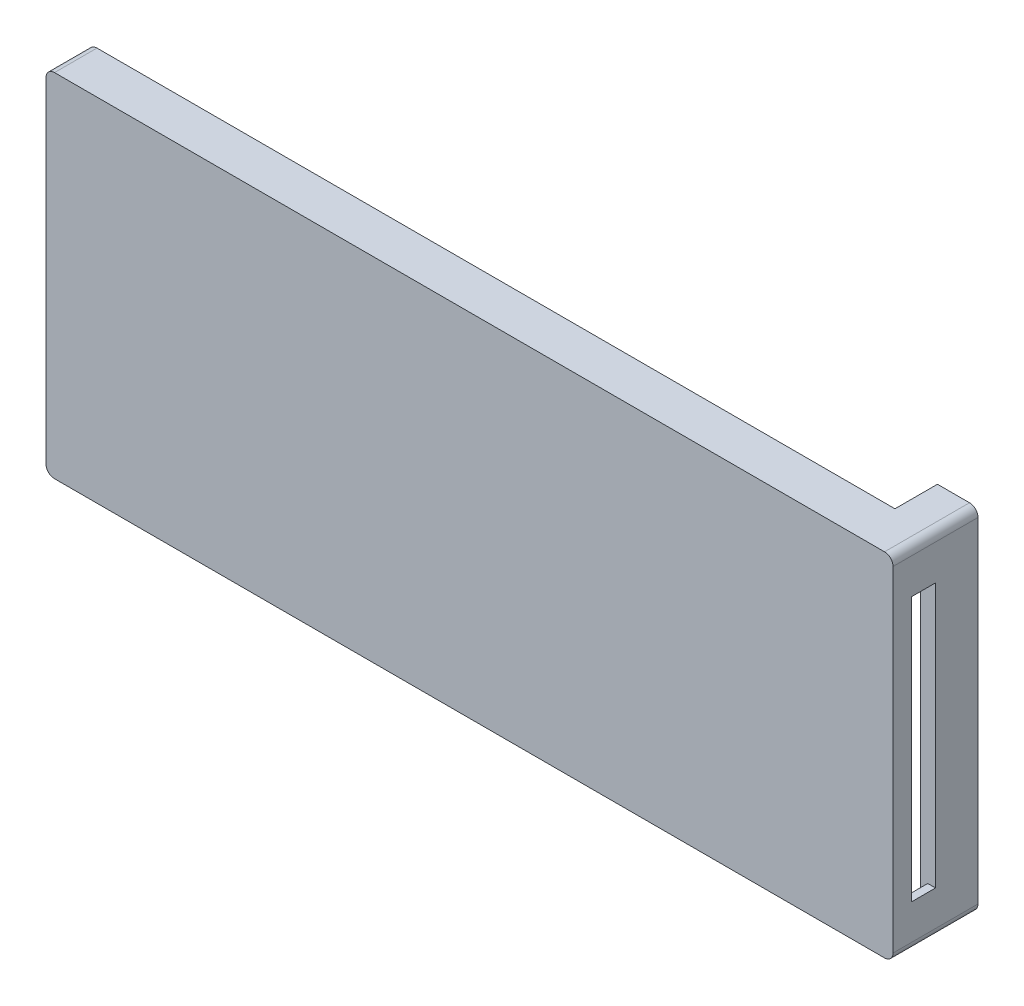
from build123d import *

# Parameters (mm, degrees)
ESQUISSE1_W             = 199.383138687
ESQUISSE1_H             = 82.793301959
BOSS_EXTRU_1_DEPTH      = 10
ESQUISSE2_W             = 9.546755773
ESQUISSE2_H             = 82.793301959
BOSS_EXTRU_3_DEPTH      = 10
ESQUISSE3_W             = 7.522297827
ESQUISSE3_H             = 80.237843489
ENL_V_MAT_EXTRU_1_DEPTH = 6
ESQUISSE4_W             = 194.871216777
ESQUISSE4_H             = 77.918512405
ENL_V_MAT_EXTRU_2_DEPTH = 6
ESQUISSE5_W             = 5.655894549
ESQUISSE5_H             = 62.197790312
ENL_V_MAT_EXTRU_3_DEPTH = 6
CONG_1_R                = 2
CONG_2_R                = 2
CONG_3_R                = 2
CONG_4_R                = 2


with BuildPart() as part:
    # Esquisse1 → Boss.-Extru.1 (new body)
    with BuildSketch(Plane.XY):
        with Locations((99.691569344, 41.39665098)):
            Rectangle(ESQUISSE1_W, ESQUISSE1_H)
    extrude(amount=BOSS_EXTRU_1_DEPTH)

    # Esquisse2 → Boss.-Extru.3 (add)
    with BuildSketch(Plane(origin=(0, 0, 0), x_dir=(-1, 0, 0), z_dir=(0, 0, -1))):
        with Locations((-194.6097608, 41.39665098)):
            Rectangle(ESQUISSE2_W, ESQUISSE2_H)
    extrude(amount=BOSS_EXTRU_3_DEPTH)

    # Esquisse3 → Enlèv. mat.-Extru.1 (cut)
    with BuildSketch(Plane.ZY.offset(-189.836382914)):
        with Locations((-3.761148914, 41.217548651)):
            Rectangle(ESQUISSE3_W, ESQUISSE3_H)
    extrude(amount=-ENL_V_MAT_EXTRU_1_DEPTH, mode=Mode.SUBTRACT)

    # Esquisse4 → Enlèv. mat.-Extru.2 (cut)
    with BuildSketch(Plane(origin=(0, 0, 0), x_dir=(-1, 0, 0), z_dir=(0, 0, -1))):
        with Locations((-100.115772064, 42.377214193)):
            Rectangle(ESQUISSE4_W, ESQUISSE4_H)
    extrude(amount=-ENL_V_MAT_EXTRU_2_DEPTH, mode=Mode.SUBTRACT)

    # Esquisse5 → Enlèv. mat.-Extru.3 (cut)
    with BuildSketch(Plane(origin=(199.383138687, 0, 0), x_dir=(0, 0, -1), z_dir=(1, 0, 0))):
        with Locations((-2.827947275, 41.363585287)):
            Rectangle(ESQUISSE5_W, ESQUISSE5_H)
    extrude(amount=-ENL_V_MAT_EXTRU_3_DEPTH, mode=Mode.SUBTRACT)

    # Congé1
    cong_1_edges = [part.edges().sort_by_distance(p)[0] for p in [
        (199.383138687, 0, 0),
    ]]
    fillet(cong_1_edges, radius=CONG_1_R)

    # Congé2
    cong_2_edges = [part.edges().sort_by_distance(p)[0] for p in [
        (199.383138687, 82.793301959, 0),
    ]]
    fillet(cong_2_edges, radius=CONG_2_R)

    # Congé3
    cong_3_edges = [part.edges().sort_by_distance(p)[0] for p in [
        (0, 82.793301959, 5),
    ]]
    fillet(cong_3_edges, radius=CONG_3_R)

    # Congé4
    cong_4_edges = [part.edges().sort_by_distance(p)[0] for p in [
        (0, 0, 5),
    ]]
    fillet(cong_4_edges, radius=CONG_4_R)


solid = part.part
